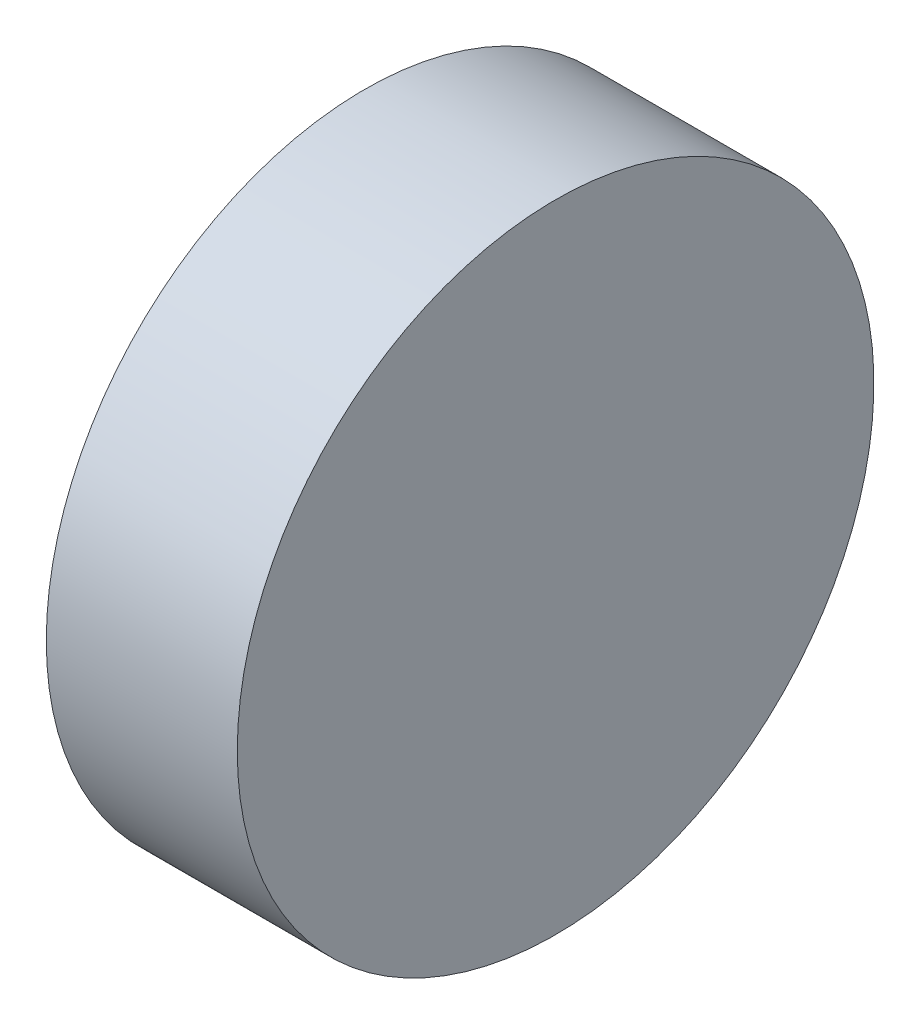
from build123d import *

# Parameters (mm, degrees)
SKETCH1_R           = 25.4
BOSS_EXTRUDE1_DEPTH = 15.24


with BuildPart() as part:
    # Sketch1 → Boss-Extrude1 (new body)
    with BuildSketch(Plane(origin=(0, 0, 0), x_dir=(0, 0, -1), z_dir=(1, 0, 0))):
        with Locations(Location((0, 0, 0), (0, 0, 180))):
            Circle(SKETCH1_R)
    extrude(amount=BOSS_EXTRUDE1_DEPTH)


solid = part.part
